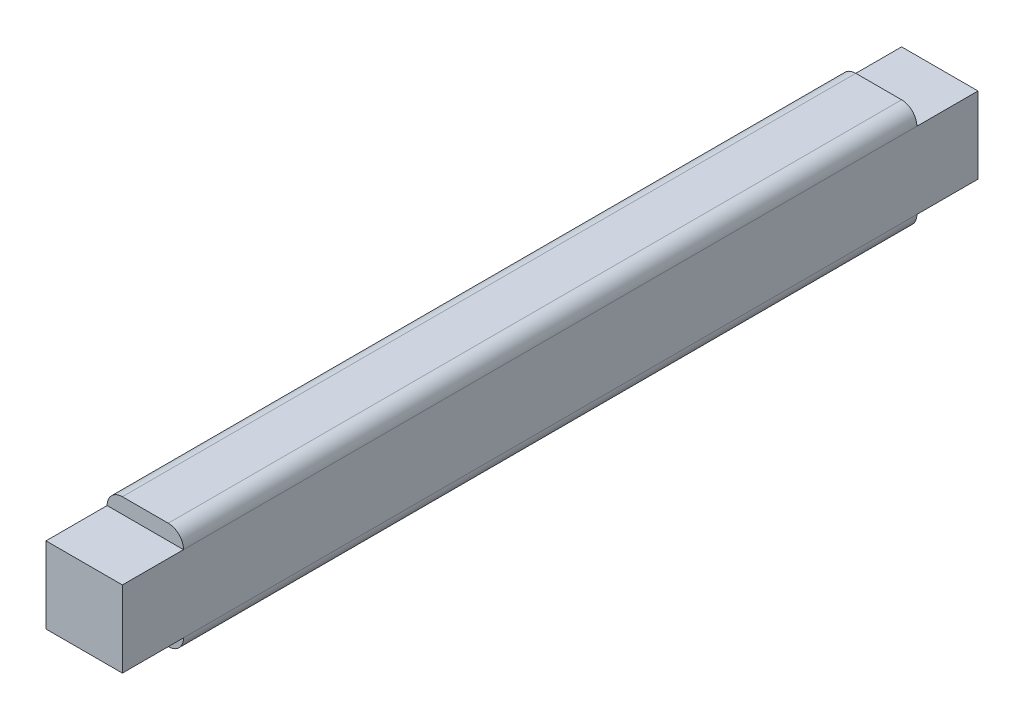
from build123d import *

# Parameters (mm, degrees)
ESQUISSE1_W             = 25
ESQUISSE1_H             = 35
BOSS_EXTRU_1_DEPTH      = 280
ESQUISSE2_OUTSIDE_W     = 83.656
ESQUISSE2_OUTSIDE_H     = 93.656
ESQUISSE2_OUTSIDE_W_2   = 25
ESQUISSE2_OUTSIDE_H_2   = 25
ENL_V_MAT_EXTRU_2_DEPTH = 20
ENL_V_START             = -280
ESQUISSE2_2_OUTSIDE_W   = 83.656
ESQUISSE2_2_OUTSIDE_H   = 93.656
ESQUISSE2_2_OUTSIDE_W_2 = 25
ESQUISSE2_2_OUTSIDE_H_2 = 25
ENL_V_MAT_EXTRU_3_DEPTH = 20
CONG_1_R                = 5


with BuildPart() as part:
    # Esquisse1 → Boss.-Extru.1 (new body)
    with BuildSketch(Plane.XY):
        with Locations((12.5, 17.5)):
            Rectangle(ESQUISSE1_W, ESQUISSE1_H)
    extrude(amount=BOSS_EXTRU_1_DEPTH)

    # Esquisse2 outside → Enlèv. mat.-Extru.2 (cut)
    with BuildSketch(Plane.XY.offset(280)):
        with Locations((12.5, 17.5)):
            Rectangle(ESQUISSE2_OUTSIDE_W, ESQUISSE2_OUTSIDE_H)
        with Locations((12.5, 17.5)):
            Rectangle(ESQUISSE2_OUTSIDE_W_2, ESQUISSE2_OUTSIDE_H_2, mode=Mode.SUBTRACT)
    extrude(amount=-ENL_V_MAT_EXTRU_2_DEPTH, mode=Mode.SUBTRACT)

    # Esquisse2<2> outside → Enlèv. mat.-Extru.3 (cut)
    with BuildSketch(Plane.XY.offset(280).offset(ENL_V_START)):
        with Locations((12.5, 17.5)):
            Rectangle(ESQUISSE2_2_OUTSIDE_W, ESQUISSE2_2_OUTSIDE_H)
        with Locations((12.5, 17.5)):
            Rectangle(ESQUISSE2_2_OUTSIDE_W_2, ESQUISSE2_2_OUTSIDE_H_2, mode=Mode.SUBTRACT)
    extrude(amount=ENL_V_MAT_EXTRU_3_DEPTH, mode=Mode.SUBTRACT)

    # Congé1
    cong_1_edges = [part.edges().sort_by_distance(p)[0] for p in [
        (0, 0, 140),
        (25, 0, 140),
        (25, 35, 140),
        (0, 35, 140),
    ]]
    fillet(cong_1_edges, radius=CONG_1_R)


solid = part.part
